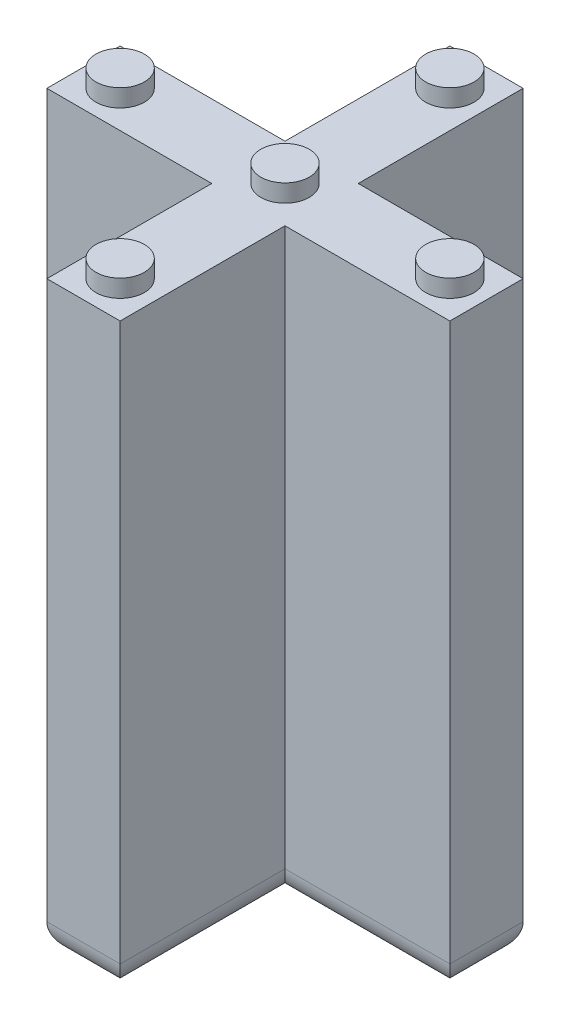
from build123d import *

# Parameters (mm, degrees)
BOSS_EXTRUDE1_DEPTH = 40
SKETCH2_R           = 1.65
BOSS_EXTRUDE2_DEPTH = 1.2
FILLET2_R           = 2


with BuildPart() as part:
    # Sketch1 → Boss-Extrude1 (new body)
    with BuildSketch(Plane(origin=(0, 0, 0), x_dir=(1, 0, 0), z_dir=(0, 1, 0))):
        Polygon((-2.5, -13.75), (2.5, -13.75), (2.5, -2.5), (13.75, -2.5), (13.75, 2.5), (2.5, 2.5), (2.5, 13.75), (-2.5, 13.75), (-2.5, 2.5), (-13.75, 2.5), (-13.75, -2.5), (-2.5, -2.5), align=None)
    extrude(amount=BOSS_EXTRUDE1_DEPTH)

    # Sketch2 → Boss-Extrude2 (add)
    with BuildSketch(Plane(origin=(0, 40, 0), x_dir=(1, 0, 0), z_dir=(0, 1, 0))):
        with Locations(Location((0, 0, 0), (0, 0, 270))):
            Circle(SKETCH2_R)
        with Locations(Location((11.25, 0, 0), (0, 0, 270))):
            Circle(SKETCH2_R)
        with Locations(Location((-11.25, 0, 0), (0, 0, 270))):
            Circle(SKETCH2_R)
        with Locations(Location((0, 11.25, 0), (0, 0, 270))):
            Circle(SKETCH2_R)
        with Locations(Location((0, -11.25, 0), (0, 0, 270))):
            Circle(SKETCH2_R)
    extrude(amount=BOSS_EXTRUDE2_DEPTH)

    # Fillet2
    fillet2_edges = [part.edges().sort_by_distance(p)[0] for p in [
        (13.75, 0, 0),
        (8.125, 0, 2.5),
        (2.5, 0, 8.125),
        (0, 0, 13.75),
        (-2.5, 0, 8.125),
        (-8.125, 0, 2.5),
        (-13.75, 0, 0),
        (-8.125, 0, -2.5),
        (-2.5, 0, -8.125),
        (0, 0, -13.75),
        (2.5, 0, -8.125),
        (8.125, 0, -2.5),
    ]]
    fillet(fillet2_edges, radius=FILLET2_R)


solid = part.part
